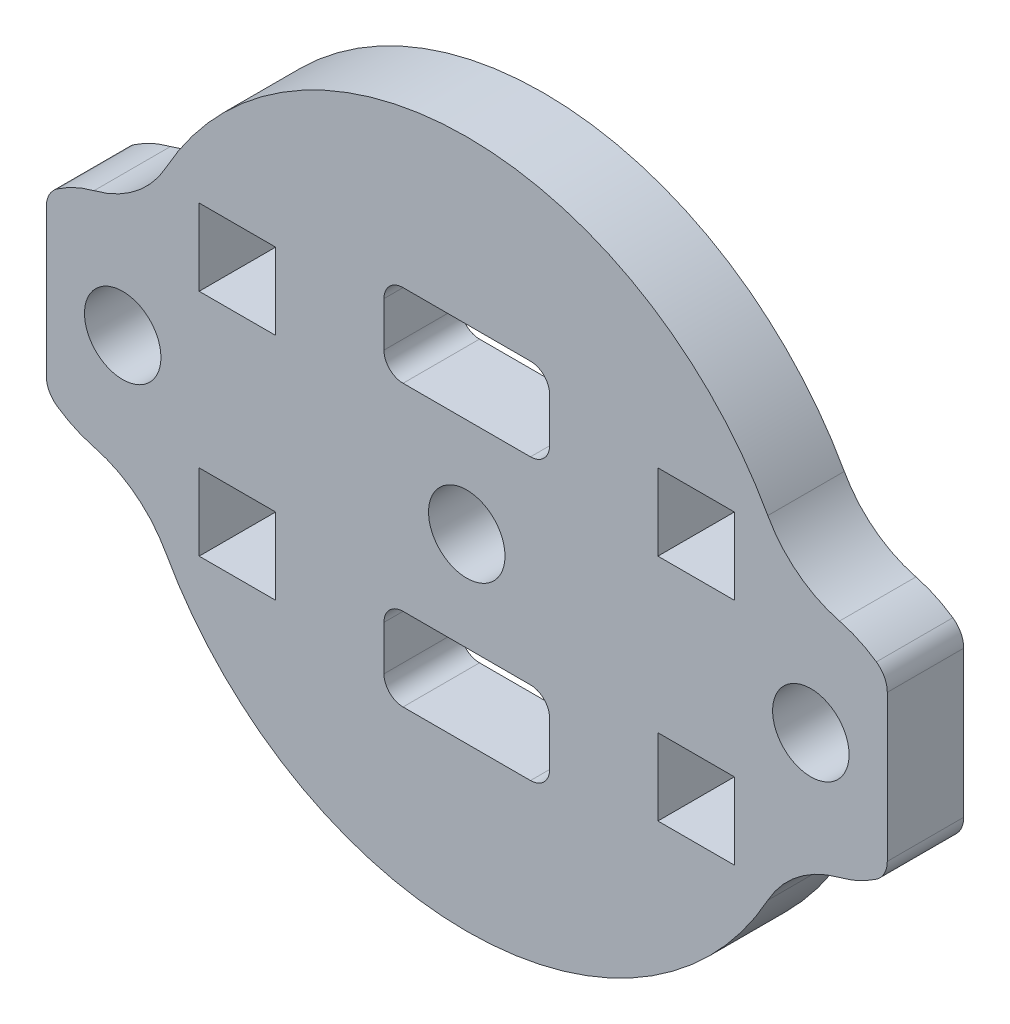
from build123d import *

# Parameters (mm, degrees)
MODEL_R                 = 1.5
MODEL_W                 = 3
MODEL_H                 = 3
SALIENTE_EXTRUIR1_DEPTH = 3


with BuildPart() as part:
    # Model → Saliente-Extruir1 (new body)
    with BuildSketch(Plane.XY):
        with BuildLine():
            Line((10.993657745, 286.638352596), (10.993657745, 280.893789949))
            ThreePointArc((10.993657745, 280.893789949), (11.107252484, 280.430879899), (11.422229173, 280.073138143))
            ThreePointArc((11.422229173, 280.073138143), (12.115845844, 279.676594232), (12.868657745, 279.408965008))
            ThreePointArc((12.868657745, 279.408965008), (14.499333705, 278.609421111), (15.681157745, 277.230411876))
            ThreePointArc((15.681157745, 277.230411876), (27.493657745, 270.266071273), (39.306157745, 277.230411876))
            ThreePointArc((39.306157745, 277.230411876), (40.487981784, 278.609421111), (42.118657745, 279.408965008))
            ThreePointArc((42.118657745, 279.408965008), (42.871469645, 279.676594232), (43.565086316, 280.073138143))
            ThreePointArc((43.565086316, 280.073138143), (43.880063005, 280.430879899), (43.993657745, 280.893789949))
            Line((43.993657745, 280.893789949), (43.993657745, 286.638352596))
            ThreePointArc((43.993657745, 286.638352596), (43.880063005, 287.101262646), (43.565086316, 287.459004403))
            ThreePointArc((43.565086316, 287.459004403), (42.871469645, 287.855548313), (42.118657745, 288.123177537))
            ThreePointArc((42.118657745, 288.123177537), (40.487981784, 288.922721434), (39.306157745, 290.301730669))
            ThreePointArc((39.306157745, 290.301730669), (27.493657745, 297.266071273), (15.681157745, 290.301730669))
            ThreePointArc((15.681157745, 290.301730669), (14.499333705, 288.922721434), (12.868657745, 288.123177537))
            ThreePointArc((12.868657745, 288.123177537), (12.115845844, 287.855548313), (11.422229173, 287.459004403))
            ThreePointArc((11.422229173, 287.459004403), (11.107252484, 287.101262646), (10.993657745, 286.638352596))
        make_face()
        with Locations((40.993657745, 283.766071273)):
            Circle(MODEL_R, mode=Mode.SUBTRACT)
        with Locations((13.993657745, 283.766071273)):
            Circle(MODEL_R, mode=Mode.SUBTRACT)
        with Locations((27.493657745, 283.766071273)):
            Circle(MODEL_R, mode=Mode.SUBTRACT)
        with Locations((36.493657745, 288.266071273)):
            Rectangle(MODEL_W, MODEL_H, mode=Mode.SUBTRACT)
        with Locations((36.493657745, 279.266071273)):
            Rectangle(MODEL_W, MODEL_H, mode=Mode.SUBTRACT)
        with Locations((18.493657745, 288.266071273)):
            Rectangle(MODEL_W, MODEL_H, mode=Mode.SUBTRACT)
        with Locations((18.493657745, 279.266071273)):
            Rectangle(MODEL_W, MODEL_H, mode=Mode.SUBTRACT)
        with BuildLine():
            Line((30.743657745, 277.391071273), (30.743657745, 279.141071273))
            ThreePointArc((30.743657745, 279.141071273), (30.52398783, 279.671401358), (29.993657745, 279.891071273))
            Line((29.993657745, 279.891071273), (24.993657745, 279.891071273))
            ThreePointArc((24.993657745, 279.891071273), (24.463327659, 279.671401358), (24.243657745, 279.141071273))
            Line((24.243657745, 279.141071273), (24.243657745, 277.391071273))
            ThreePointArc((24.243657745, 277.391071273), (24.463327659, 276.860741187), (24.993657745, 276.641071273))
            Line((24.993657745, 276.641071273), (29.993657745, 276.641071273))
            ThreePointArc((29.993657745, 276.641071273), (30.52398783, 276.860741187), (30.743657745, 277.391071273))
        make_face(mode=Mode.SUBTRACT)
        with BuildLine():
            Line((30.743657745, 290.141071273), (30.743657745, 288.391071273))
            ThreePointArc((30.743657745, 288.391071273), (30.52398783, 287.860741187), (29.993657745, 287.641071273))
            Line((29.993657745, 287.641071273), (24.993657745, 287.641071273))
            ThreePointArc((24.993657745, 287.641071273), (24.463327659, 287.860741187), (24.243657745, 288.391071273))
            Line((24.243657745, 288.391071273), (24.243657745, 290.141071273))
            ThreePointArc((24.243657745, 290.141071273), (24.463327659, 290.671401358), (24.993657745, 290.891071273))
            Line((24.993657745, 290.891071273), (29.993657745, 290.891071273))
            ThreePointArc((29.993657745, 290.891071273), (30.52398783, 290.671401358), (30.743657745, 290.141071273))
        make_face(mode=Mode.SUBTRACT)
    extrude(amount=SALIENTE_EXTRUIR1_DEPTH)


solid = part.part
